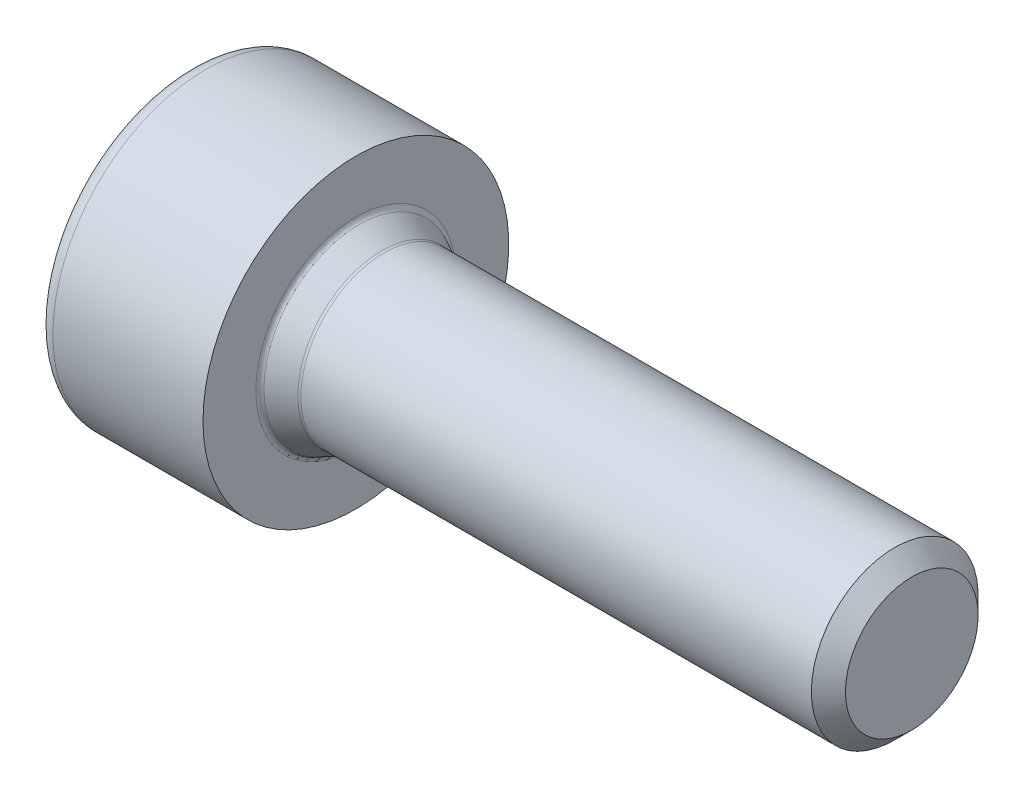
from build123d import *

# Parameters (mm, degrees)
CUT_EXTRUDE_1_DEPTH = 2.6
SKETCH_3_R          = 2.0625
EXTRUDE_1_DEPTH     = 1.5


with BuildPart() as part:
    # 草图1 → 旋转1 (revolve)
    with BuildSketch(Plane.XY, mode=Mode.PRIVATE) as revolve_1_sk:
        with BuildLine():
            Line((-0.428312164, 0), (-1.15, 1.25))
            Line((-1.15, 1.25), (-3, 1.25))
            Line((-3, 1.25), (-3, 2.45))
            ThreePointArc((-3, 2.45), (-2.912132034, 2.662132034), (-2.7, 2.75))
            Line((-2.7, 2.75), (0, 2.75))
            Line((0, 2.75), (0, 1.8))
            ThreePointArc((0, 1.8), (0.015193643, 1.74701055), (0.056157637, 1.710123155))
            Line((0.056157637, 1.710123155), (0.466157637, 1.510123155))
            ThreePointArc((0.466157637, 1.510123155), (0.48750205, 1.50256365), (0.51, 1.5))
            Line((0.51, 1.5), (9.6935, 1.5))
            Line((9.6935, 1.5), (10, 1.1935))
            Line((10, 1.1935), (10, 0))
            Line((10, 0), (-0.428312164, 0))
        make_face()
    revolve(revolve_1_sk.sketch.rotate(Axis((10, 0, 0), (-1, 0, 0)), 270), axis=Axis((10, 0, 0), (-1, 0, 0)))

    # 草图2 → 切除-拉伸1 (cut)
    with BuildSketch(Plane(origin=(-1.15, 0, 0), x_dir=(0, 0, -1), z_dir=(1, 0, 0))):
        Polygon((-1.25, 0.721687836), (-1.25, -0.721687836), (0, -1.443375673), (1.25, -0.721687836), (1.25, 0.721687836), (0, 1.443375673), align=None)
    extrude(amount=-CUT_EXTRUDE_1_DEPTH, mode=Mode.SUBTRACT)


with BuildPart() as body_2:
    # 草图3 → 凸台-拉伸1 (new body)
    with BuildSketch(Plane(origin=(0, 0, 0), x_dir=(0, 0, -1), z_dir=(1, 0, 0))):
        Circle(SKETCH_3_R)
    extrude(amount=-EXTRUDE_1_DEPTH)

    # Delete Face 1: 1 face struck out; the rest of the skin is kept as a surface, the solid goes
    delete_face_1_1_drop = [body_2.part.faces().sort_by_distance(Vector(p))[0] for p in ((-1.5, 0, 0),)]
    delete_face_1_1 = Shell(body_2.part.faces() - delete_face_1_1_drop)


solid = part.part
